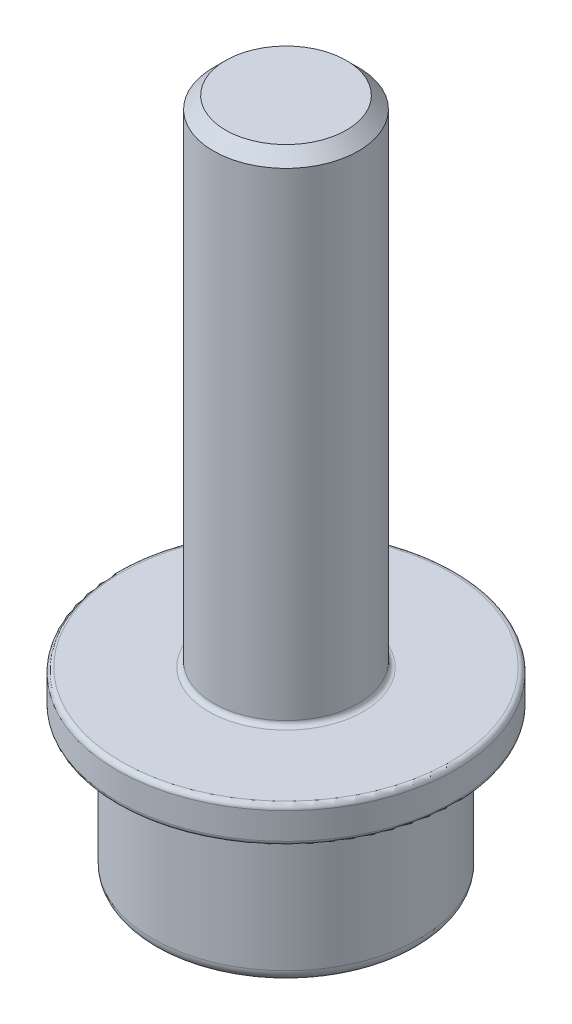
from build123d import *

# Parameters (mm, degrees)
SKETCH1_R           = 2.75
BOSS_EXTRUDE1_DEPTH = 3
SKETCH2_R           = 1.5
BOSS_EXTRUDE2_DEPTH = 11
CUT_EXTRUDE1_DEPTH  = 1.5
CHAMFER1_SIZE       = 0.25
FILLET1_R           = 0.25
CHAMFER2_SIZE       = 0.25
FILLET2_R           = 0.1
SKETCH4_R           = 3.5
SKETCH4_R_2         = 1.5
BOSS_EXTRUDE3_DEPTH = 0.75
FILLET3_R           = 0.1


with BuildPart() as part:
    # Sketch1 → Boss-Extrude1 (new body)
    with BuildSketch(Plane(origin=(0, 0, 0), x_dir=(1, 0, 0), z_dir=(0, 1, 0))):
        with Locations(Location((0, 0, 0), (0, 0, 270))):
            Circle(SKETCH1_R)
    extrude(amount=BOSS_EXTRUDE1_DEPTH)

    # Sketch2 → Boss-Extrude2 (add)
    with BuildSketch(Plane(origin=(0, 3, 0), x_dir=(1, 0, 0), z_dir=(0, 1, 0))):
        with Locations(Location((0, 0, 0), (0, 0, 270))):
            Circle(SKETCH2_R)
    extrude(amount=BOSS_EXTRUDE2_DEPTH)

    # Sketch3 → Cut-Extrude1 (cut)
    with BuildSketch(Plane.XZ):
        Polygon((0.934168857, 0.974591477), (-0.376936549, 1.2963097), (-1.311105406, 0.321718223), (-0.934168857, -0.974591477), (0.376936549, -1.2963097), (1.311105406, -0.321718223), align=None)
    extrude(amount=-CUT_EXTRUDE1_DEPTH, mode=Mode.SUBTRACT)

    # Chamfer1
    chamfer1_edges = [part.edges().sort_by_distance(p)[0] for p in [
        (1.122637131, 0, 0.326436627),
        (0.278616154, 0, 1.135450588),
        (-0.844020977, 0, 0.809013962),
        (-1.122637131, 0, -0.326436627),
        (-0.278616154, 0, -1.135450588),
        (0.844020977, 0, -0.809013962),
    ]]
    chamfer(chamfer1_edges, length=CHAMFER1_SIZE)

    # Fillet1
    fillet1_edges = [part.edges().sort_by_distance(p)[0] for p in [
        (0, 0, -2.75),
    ]]
    fillet(fillet1_edges, radius=FILLET1_R)

    # Chamfer2
    chamfer2_edges = [part.edges().sort_by_distance(p)[0] for p in [
        (0, 14, -1.5),
    ]]
    chamfer(chamfer2_edges, length=CHAMFER2_SIZE)

    # Fillet2
    fillet2_edges = [part.edges().sort_by_distance(p)[0] for p in [
        (0, 3, -2.75),
    ]]
    fillet(fillet2_edges, radius=FILLET2_R)

    # Sketch4 → Boss-Extrude3 (add)
    with BuildSketch(Plane(origin=(0, 3, 0), x_dir=(1, 0, 0), z_dir=(0, 1, 0))):
        with Locations(Location((0, 0, 0), (0, 0, 270))):
            Circle(SKETCH4_R)
        with Locations(Location((0, 0, 0), (0, 0, 270))):
            Circle(SKETCH4_R_2, mode=Mode.SUBTRACT)
    extrude(amount=BOSS_EXTRUDE3_DEPTH)

    # Fillet3
    fillet3_edges = [part.edges().sort_by_distance(p)[0] for p in [
        (0, 3.75, -3.5),
        (0, 3, -3.5),
        (0, 3.75, -1.5),
    ]]
    fillet(fillet3_edges, radius=FILLET3_R)


solid = part.part
